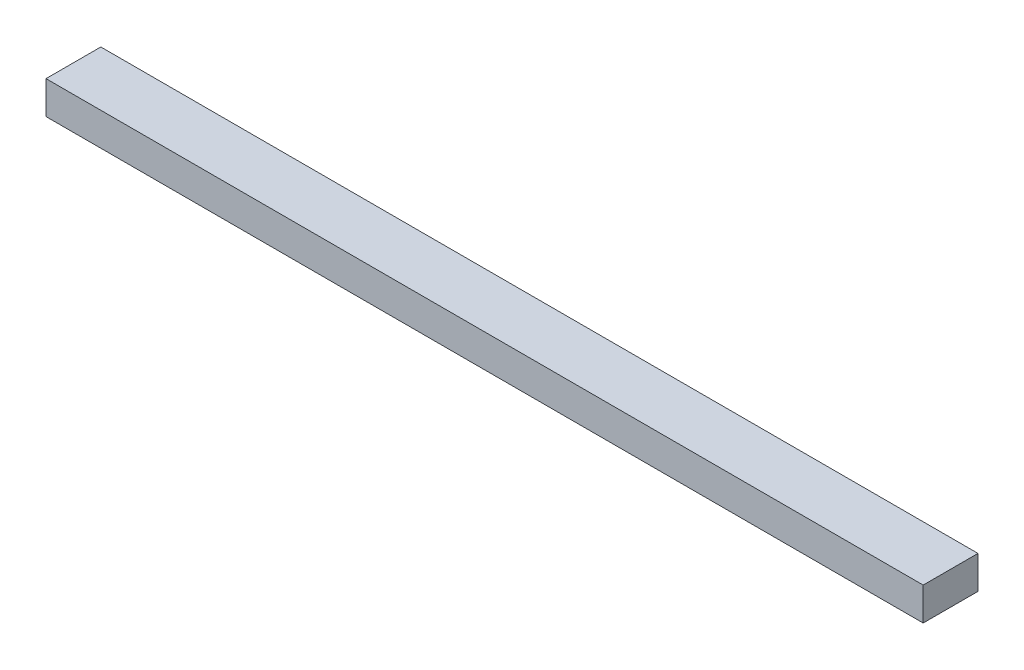
from build123d import *

# Parameters (mm, degrees)
SKETCH_1_W      = 80
SKETCH_1_H      = 3
EXTRUDE_1_DEPTH = 5


with BuildPart() as part:
    # 草图1 → 凸台-拉伸1 (new body)
    with BuildSketch(Plane.XY):
        with Locations((37.125, -1.0625)):
            Rectangle(SKETCH_1_W, SKETCH_1_H)
    extrude(amount=EXTRUDE_1_DEPTH)


solid = part.part
